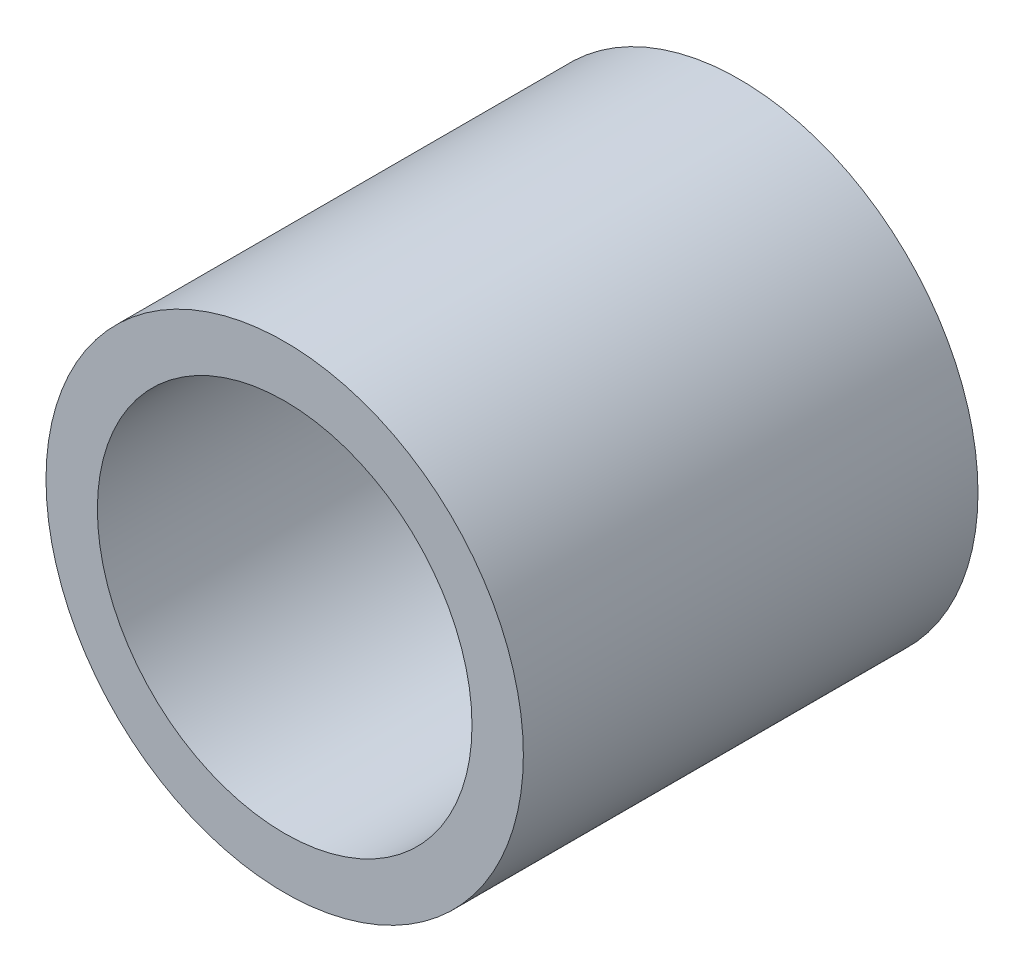
from build123d import *

# Parameters (mm, degrees)
SKETCH1_R           = 13.335
SKETCH1_R_2         = 10.4648
BOSS_EXTRUDE1_DEPTH = 25.4


with BuildPart() as part:
    # Sketch1 → Boss-Extrude1 (new body)
    with BuildSketch(Plane.XY):
        Circle(SKETCH1_R)
        Circle(SKETCH1_R_2, mode=Mode.SUBTRACT)
    extrude(amount=BOSS_EXTRUDE1_DEPTH)


solid = part.part
